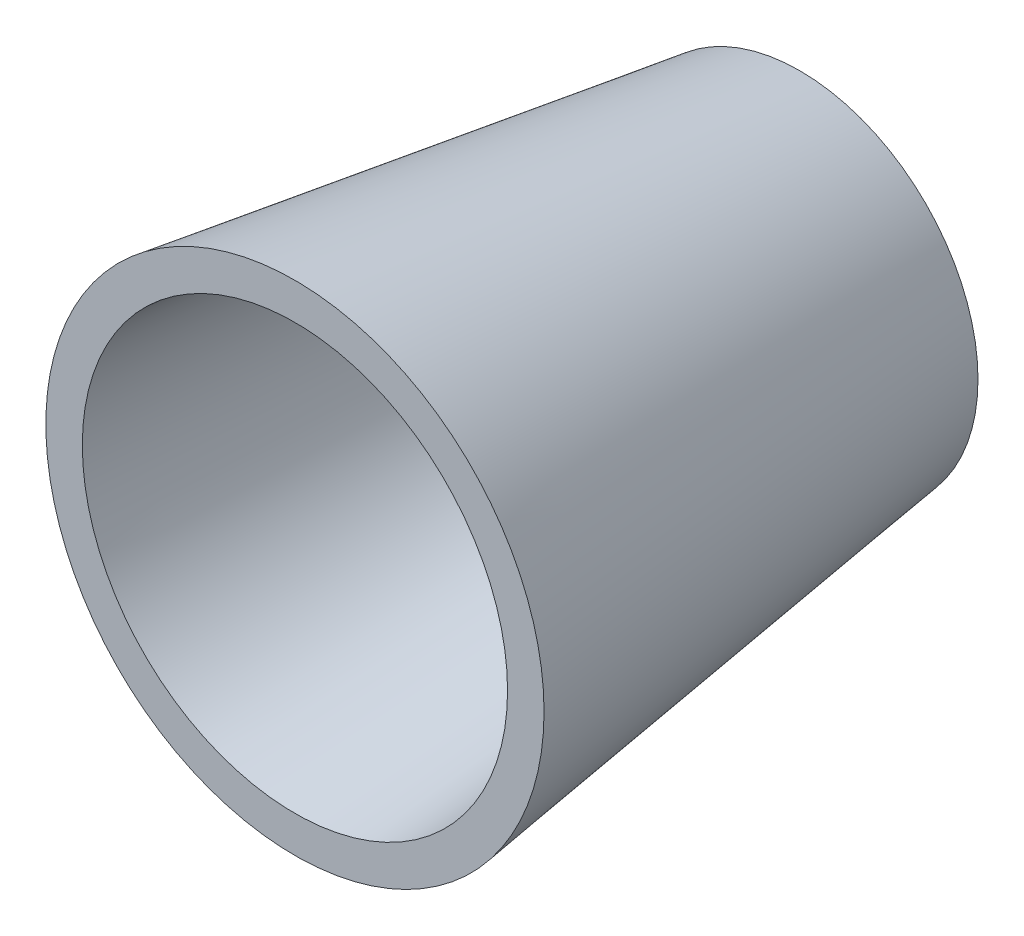
from build123d import *

# Parameters (mm, degrees)
SKETCH2_R           = 52.927862015
BOSS_EXTRUDE2_DEPTH = 150
BOSS_EXTRUDE2_DRAFT = -8
SKETCH6_R           = 36.849119173
CUT_EXTRUDE2_DEPTH  = 130
SKETCH8_R           = 63.168740943
CUT_EXTRUDE4_DEPTH  = 141
CUT_EXTRUDE4_DRAFT  = -5


with BuildPart() as part:
    # Sketch2 → Boss-Extrude2 (with draft: the straight prism first)
    with BuildSketch(Plane.XY):
        Circle(SKETCH2_R)
    extrude(amount=BOSS_EXTRUDE2_DEPTH)
    # Boss-Extrude2: the draft: its side faces are tilted about the plane it starts from
    boss_extrude2_sides = [part.faces().sort_by_distance(p)[0] for p in [
        (-52.927862015, 0, 75),
    ]]
    draft(boss_extrude2_sides, Plane.XY, BOSS_EXTRUDE2_DRAFT)

    # Sketch6 → Cut-Extrude2 (cut)
    with BuildSketch(Plane(origin=(0, 0, 0), x_dir=(-1, 0, 0), z_dir=(0, 0, -1))):
        Circle(SKETCH6_R)
    extrude(amount=-CUT_EXTRUDE2_DEPTH, mode=Mode.SUBTRACT)


with BuildPart() as cut_extrude4_tool:
    # Sketch8 → Cut-Extrude4 (with draft: the straight prism first)
    with BuildSketch(Plane.XY.offset(150)):
        Circle(SKETCH8_R)
    extrude(amount=-CUT_EXTRUDE4_DEPTH)
    # Cut-Extrude4: the draft: its side faces are tilted about the plane it starts from
    cut_extrude4_sides = [cut_extrude4_tool.faces().sort_by_distance(p)[0] for p in [
        (-63.168740943, 0, 79.5),
    ]]
    draft(cut_extrude4_sides, Plane.XY.offset(150), CUT_EXTRUDE4_DRAFT)


with BuildPart() as part_1:
    add(part.part)

    # Cut-Extrude4: cut by cut_extrude4_tool
    add(cut_extrude4_tool.part, mode=Mode.SUBTRACT)


solid = part_1.part
